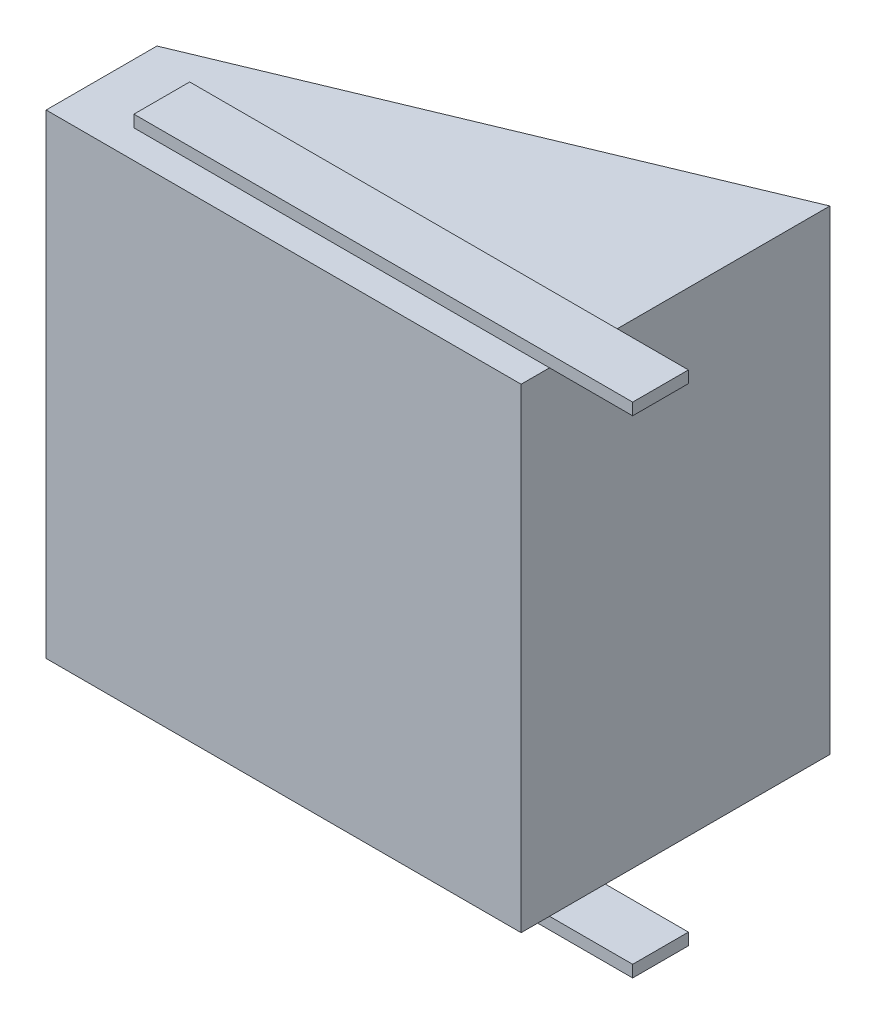
from build123d import *

# Parameters (mm, degrees)
SKETCH1_W                = 80
SKETCH1_H                = 80
BOSS_EXTRUDE1_DEPTH      = 2
SKETCH2_W                = 80
SKETCH2_H                = 2
BOSS_EXTRUDE2_DEPTH      = 50
SKETCH3_W                = 2
SKETCH3_H                = 76
BOSS_EXTRUDE3_DEPTH      = 50
CUT_EXTRUDE2_DEPTH       = 100
SKETCH6_W                = 2
SKETCH6_H                = 76
BOSS_EXTRUDE4_DEPTH      = 16.666666667
BOSS_EXTRUDE5_DEPTH      = 2
BOSS_EXTRUDE5_DEPTH_BACK = 82
SKETCH7_W                = 84
SKETCH7_H                = 9.392000317
SKETCH8_W                = 14
SKETCH8_H                = 80
CUT_EXTRUDE3_DEPTH       = 50


with BuildPart() as part:
    # Sketch1 → Boss-Extrude1 (new body)
    with BuildSketch(Plane.XY):
        with Locations((40, 40)):
            Rectangle(SKETCH1_W, SKETCH1_H)
    extrude(amount=BOSS_EXTRUDE1_DEPTH)

    # Sketch2 → Boss-Extrude2 (add)
    with BuildSketch(Plane(origin=(0, 0, 0), x_dir=(-1, 0, 0), z_dir=(0, 0, -1))):
        with Locations((-40, 79)):
            Rectangle(SKETCH2_W, SKETCH2_H)
        with Locations((-40, 1)):
            Rectangle(SKETCH2_W, SKETCH2_H)
    extrude(amount=BOSS_EXTRUDE2_DEPTH)

    # Sketch3 → Boss-Extrude3 (add)
    with BuildSketch(Plane(origin=(0, 0, 0), x_dir=(-1, 0, 0), z_dir=(0, 0, -1))):
        with Locations((-79, 40)):
            Rectangle(SKETCH3_W, SKETCH3_H)
    extrude(amount=BOSS_EXTRUDE3_DEPTH)

    # Sketch5 → Cut-Extrude2 (cut)
    with BuildSketch(Plane(origin=(0, 80, 0), x_dir=(1, 0, 0), z_dir=(0, 1, 0))):
        Polygon((80, 50), (0, 16.666666667), (0, 50), align=None)
    extrude(amount=-CUT_EXTRUDE2_DEPTH, mode=Mode.SUBTRACT)

    # Sketch6 → Boss-Extrude4 (add)
    with BuildSketch(Plane(origin=(0, 0, 0), x_dir=(-1, 0, 0), z_dir=(0, 0, -1))):
        with Locations((-1, 40)):
            Rectangle(SKETCH6_W, SKETCH6_H)
    extrude(amount=BOSS_EXTRUDE4_DEPTH)

    # Sketch7 → Boss-Extrude5 (add, two sides: drawn at the far end of the back side and taken through both)
    with BuildSketch(Plane(origin=(0, 80, 0), x_dir=(1, 0, 0), z_dir=(0, 1, 0)).offset(-BOSS_EXTRUDE5_DEPTH_BACK)):
        with Locations((52, 7.482577596)):
            Rectangle(SKETCH7_W, SKETCH7_H)
    extrude(amount=BOSS_EXTRUDE5_DEPTH + BOSS_EXTRUDE5_DEPTH_BACK)

    # Sketch8 → Cut-Extrude3 (cut)
    with BuildSketch(Plane.XY.offset(-2.786577437)):
        with Locations((87, 40)):
            Rectangle(SKETCH8_W, SKETCH8_H)
    extrude(amount=-CUT_EXTRUDE3_DEPTH, mode=Mode.SUBTRACT)


solid = part.part
